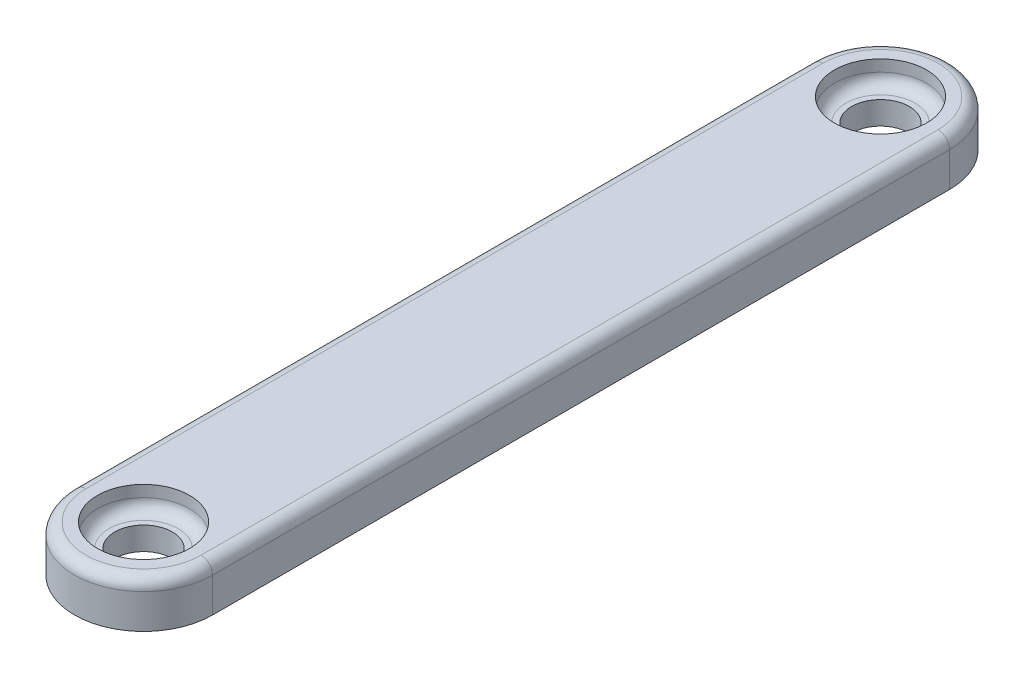
from build123d import *

# Parameters (mm, degrees)
SKETCH1_R           = 1.25
BOSS_EXTRUDE1_DEPTH = 2
SKETCH2_R           = 2
CUT_EXTRUDE1_DEPTH  = 1
FILLET1_R           = 0.5


with BuildPart() as part:
    # Sketch1 → Boss-Extrude1 (new body)
    with BuildSketch(Plane(origin=(0, 0, 0), x_dir=(1, 0, 0), z_dir=(0, 1, 0))):
        with BuildLine():
            Line((-3, -16), (-3, 16))
            ThreePointArc((-3, 16), (0, 19), (3, 16))
            Line((3, 16), (3, -16))
            ThreePointArc((3, -16), (0, -19), (-3, -16))
        make_face()
        with Locations(Location((0, 16, 0), (0, 0, 270))):
            Circle(SKETCH1_R, mode=Mode.SUBTRACT)
        with Locations(Location((0, -16, 0), (0, 0, 270))):
            Circle(SKETCH1_R, mode=Mode.SUBTRACT)
    extrude(amount=BOSS_EXTRUDE1_DEPTH)

    # Sketch2 → Cut-Extrude1 (cut)
    with BuildSketch(Plane(origin=(0, 2, 0), x_dir=(1, 0, 0), z_dir=(0, 1, 0))):
        with Locations(Location((0, -16, 0), (0, 0, 270))):
            Circle(SKETCH2_R)
        with Locations(Location((0, 16, 0), (0, 0, 90))):
            Circle(SKETCH2_R)
    extrude(amount=-CUT_EXTRUDE1_DEPTH, mode=Mode.SUBTRACT)

    # Fillet1
    fillet1_edges = [part.edges().sort_by_distance(p)[0] for p in [
        (0, 2, -19),
        (-3, 2, 0),
        (0, 1, 14),
        (0, 1, -14),
        (0, 2, 19),
        (3, 2, 0),
    ]]
    fillet(fillet1_edges, radius=FILLET1_R)


solid = part.part
